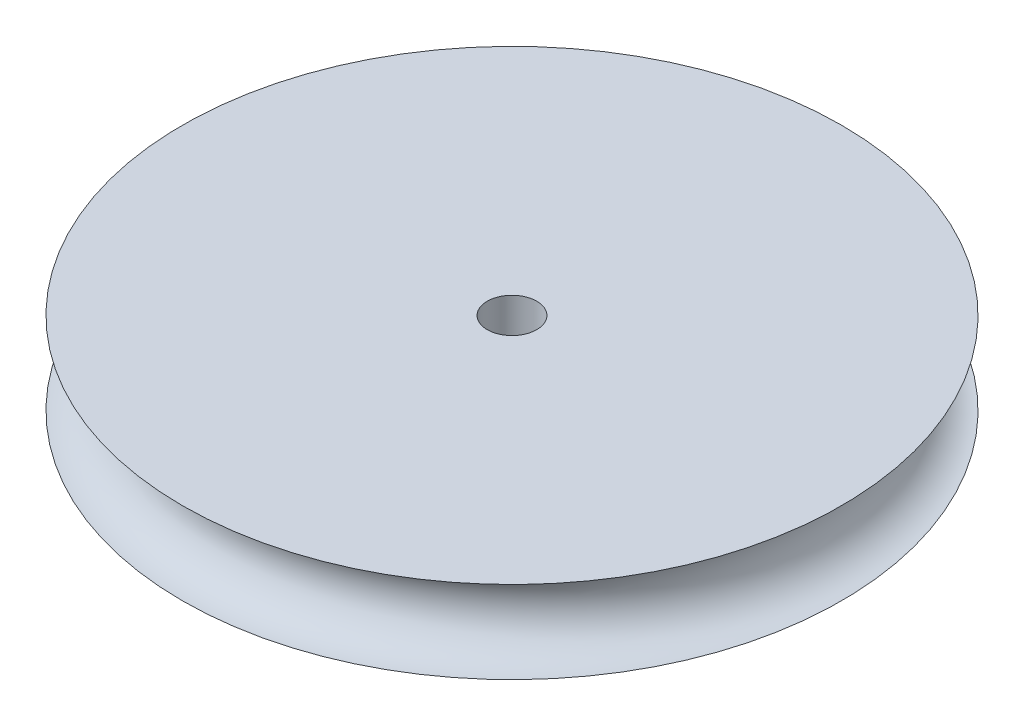
from build123d import *


with BuildPart() as part:
    # Sketch1 → Revolve1 (revolve)
    with BuildSketch(Plane.XY, mode=Mode.PRIVATE) as revolve1_sk:
        with BuildLine():
            Line((-1.5, 0), (-20, 0))
            ThreePointArc((-20, 0), (-17.5, 2.5), (-20, 5))
            Line((-20, 5), (-1.5, 5))
            Line((-1.5, 5), (-1.5, 0))
        make_face()
    revolve(revolve1_sk.sketch.rotate(Axis((0, 0, 0), (0, 1, 0)), 270), axis=Axis((0, 0, 0), (0, 1, 0)))


solid = part.part
